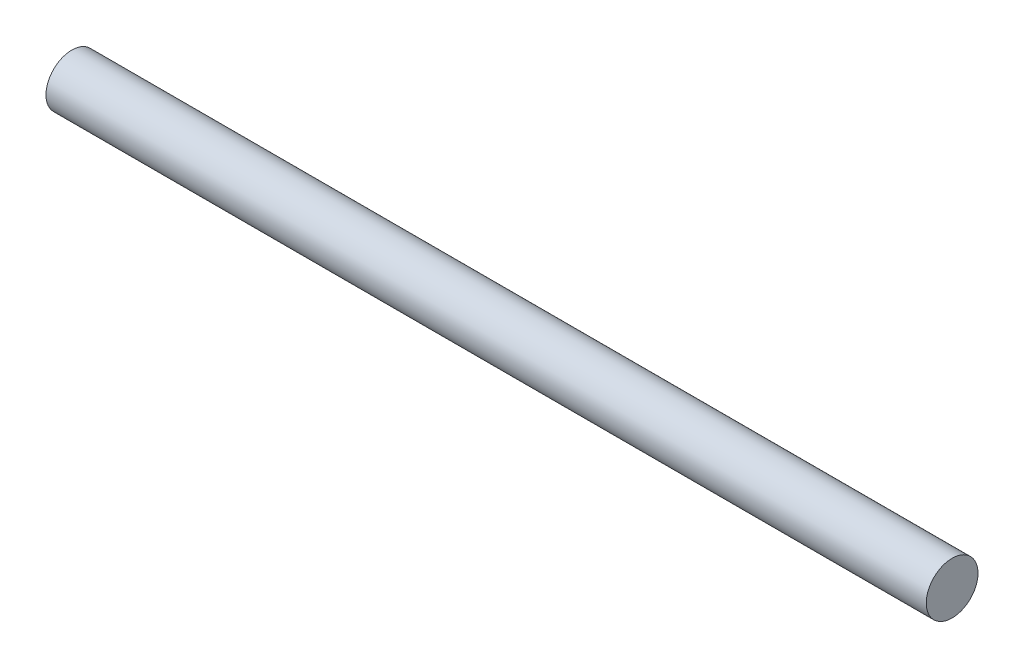
from build123d import *

# Parameters (mm, degrees)
CROQUIS1_R              = 10
SALIENTE_EXTRUIR1_DEPTH = 340


with BuildPart() as part:
    # Croquis1 → Saliente-Extruir1 (new body)
    with BuildSketch(Plane(origin=(0, 0, 0), x_dir=(0, 0, -1), z_dir=(1, 0, 0))):
        Circle(CROQUIS1_R)
    extrude(amount=SALIENTE_EXTRUIR1_DEPTH)


solid = part.part
